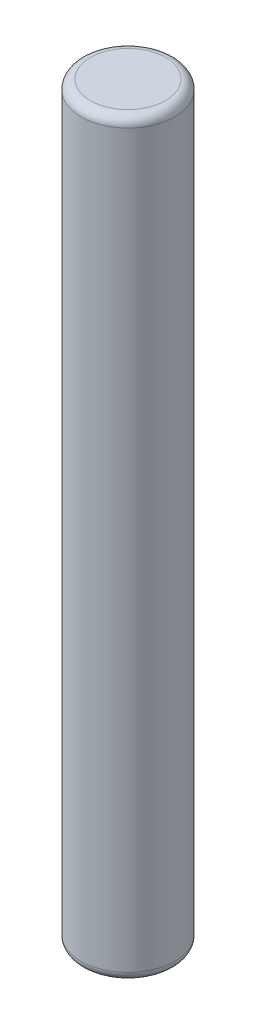
from build123d import *

# Parameters (mm, degrees)
SKETCH1_R           = 2.5
BOSS_EXTRUDE1_DEPTH = 40
FILLET1_R           = 0.5


with BuildPart() as part:
    # Sketch1 → Boss-Extrude1 (new body)
    with BuildSketch(Plane(origin=(0, 0, 0), x_dir=(1, 0, 0), z_dir=(0, 1, 0))):
        with Locations(Location((0, 0, 0), (0, 0, 270))):
            Circle(SKETCH1_R)
    extrude(amount=BOSS_EXTRUDE1_DEPTH)

    # Fillet1
    fillet1_edges = [part.edges().sort_by_distance(p)[0] for p in [
        (0, 0, -2.5),
        (0, 40, -2.5),
    ]]
    fillet(fillet1_edges, radius=FILLET1_R)


solid = part.part
